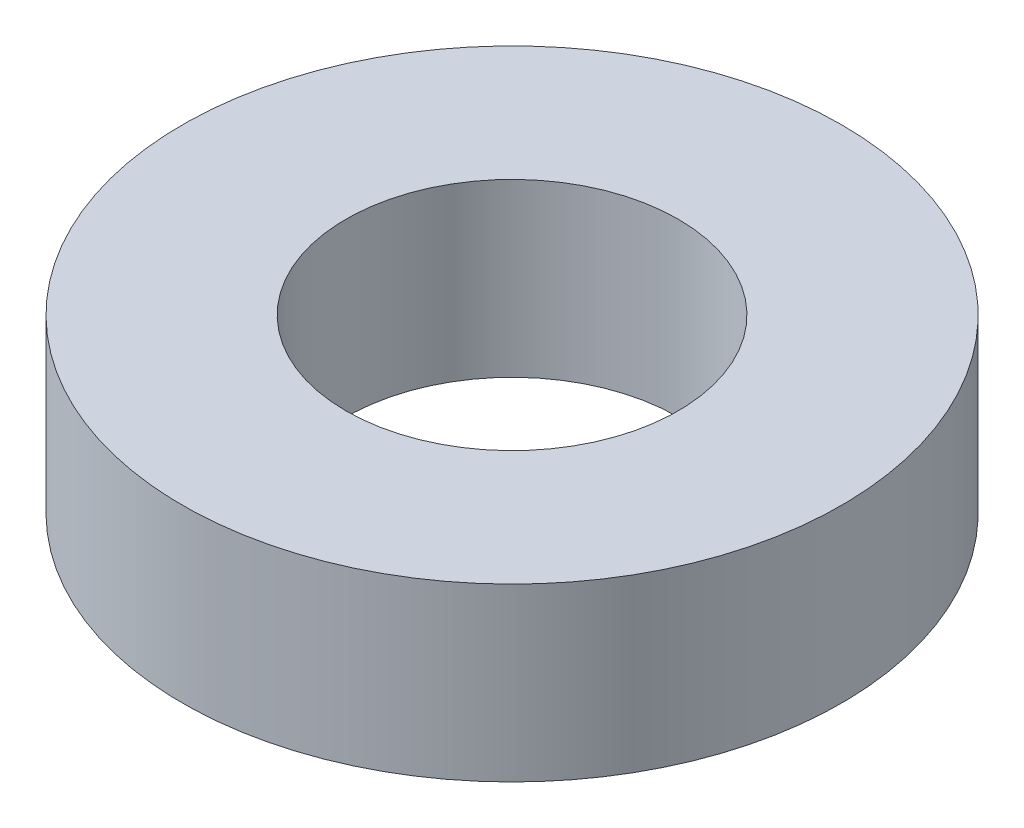
from build123d import *

# Parameters (mm, degrees)
SKETCH1_R           = 6.35
SKETCH1_R_2         = 3.2004
BOSS_EXTRUDE1_DEPTH = 3.302


with BuildPart() as part:
    # Sketch1 → Boss-Extrude1 (new body)
    with BuildSketch(Plane(origin=(0, 0, 0), x_dir=(1, 0, 0), z_dir=(0, 1, 0))):
        with Locations(Location((0, 0, 0), (0, 0, 90))):
            Circle(SKETCH1_R)
        with Locations(Location((0, 0, 0), (0, 0, 90))):
            Circle(SKETCH1_R_2, mode=Mode.SUBTRACT)
    extrude(amount=BOSS_EXTRUDE1_DEPTH)


solid = part.part
